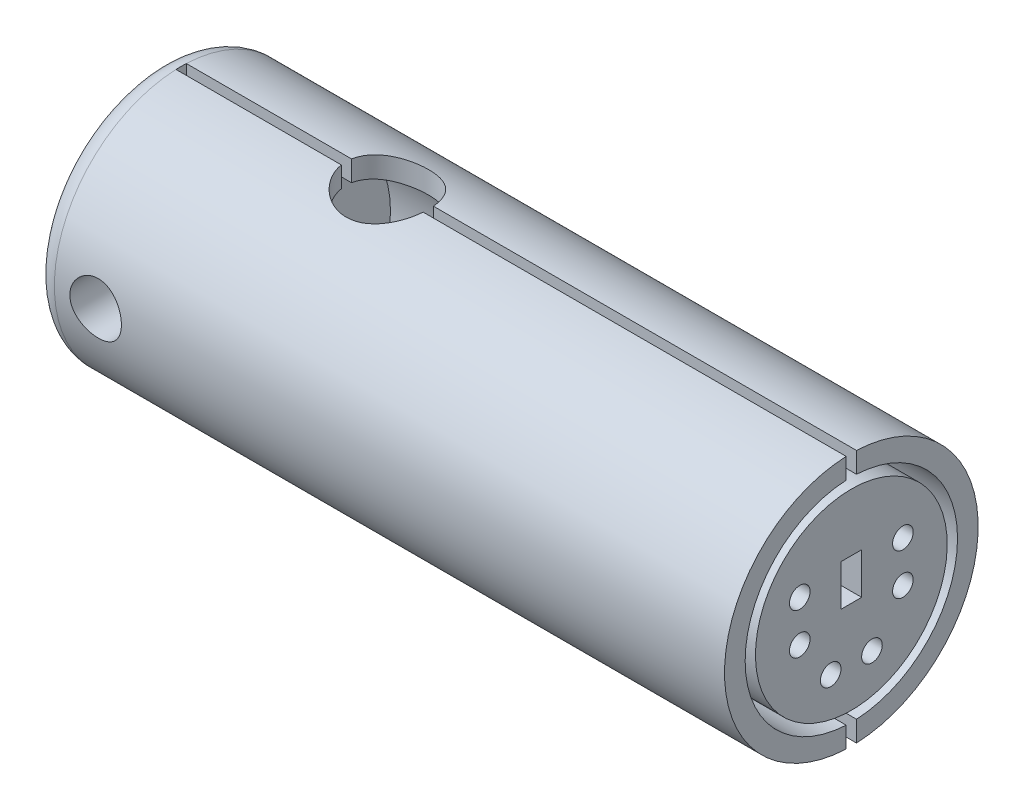
from build123d import *

# Parameters (mm, degrees)
SKETCH_1_W               = 33.5
SKETCH_1_H               = 6.15
SKETCH_2_R               = 5.15
CUT_EXTRUDE_1_DEPTH      = 27.5
SKETCH_3_R               = 2.25
CUT_EXTRUDE_2_DEPTH      = 35.610619758
SKETCH_5_W               = 0.75
SKETCH_5_H               = 4
CUT_EXTRUDE_3_DEPTH      = 35.610619758
CUT_EXTRUDE_3_DEPTH_BACK = 35.610619758
SKETCH_6_R               = 1.25
SKETCH_7_R               = 2
CUT_EXTRUDE_4_DEPTH      = 35.610619896
FILLET_1_R               = 1
CUT_EXTRUDE_START        = -32.5
SKETCH_8_W               = 0.5
SKETCH_8_H               = 12.3
CUT_EXTRUDE_5_DEPTH      = 32.5
SKETCH_9_R               = 4.65
SKETCH_9_R_2             = 0.5
SKETCH_9_W               = 1
SKETCH_9_H               = 2
EXTRUDE_1_DEPTH          = 12
EXTRUDE_START            = -5.15
SKETCH_10_R              = 1.5
EXTRUDE_2_DEPTH          = 10.3


with BuildPart() as part:
    # Эскиз1 → Повернуть1 (revolve)
    with BuildSketch(Plane.XY, mode=Mode.PRIVATE) as revolve_1_sk:
        with Locations((16.75, 3.075)):
            Rectangle(SKETCH_1_W, SKETCH_1_H)
    revolve(revolve_1_sk.sketch.rotate(Axis((0, 0, 0), (1, 0, 0)), 180), axis=Axis((0, 0, 0), (1, 0, 0)))

    # Эскиз2 → Вырез-Вытянуть1 (cut)
    with BuildSketch(Plane(origin=(33.5, 0, 0), x_dir=(0, 0, -1), z_dir=(1, 0, 0))):
        with Locations(Location((0, 0, 0), (0, 0, 90))):
            Circle(SKETCH_2_R)
    extrude(amount=-CUT_EXTRUDE_1_DEPTH, mode=Mode.SUBTRACT)

    # Эскиз3 → Вырез-Вытянуть2 (cut, through all)
    with BuildSketch(Plane.ZY):
        with Locations(Location((0, 0, 0), (0, 0, 270))):
            Circle(SKETCH_3_R)
    extrude(amount=-CUT_EXTRUDE_2_DEPTH, mode=Mode.SUBTRACT)

    # Эскиз5 → Вырез-Повернуть1 (revolve, cut)
    with BuildSketch(Plane(origin=(0, 0, 0), x_dir=(0, 1, 0), z_dir=(0, 0, 1))):
        with Locations((-2.625, -3)):
            Rectangle(SKETCH_5_W, SKETCH_5_H)
    revolve(axis=Axis((6, 0, 0), (1, 0, 0)), mode=Mode.SUBTRACT)

    # Эскиз6 → Вырез-Вытянуть3 (cut, two sides: drawn at the far end of the back side and taken through both)
    with BuildSketch(Plane(origin=(0, 0, 0), x_dir=(0, 1, 0), z_dir=(0, 0, 1)).offset(-CUT_EXTRUDE_3_DEPTH_BACK)):
        with Locations(Location((0, -3, 0), (0, 0, 270))):
            Circle(SKETCH_6_R)
    extrude(amount=CUT_EXTRUDE_3_DEPTH + CUT_EXTRUDE_3_DEPTH_BACK, mode=Mode.SUBTRACT)

    # Эскиз7 → Вырез-Вытянуть4 (cut, through all)
    with BuildSketch(Plane(origin=(0, 0, 0), x_dir=(0, 0, 1), z_dir=(0, -1, 0))):
        with Locations(Location((0, -11, 0), (0, 0, 269.999999997))):
            Circle(SKETCH_7_R)
    extrude(amount=-CUT_EXTRUDE_4_DEPTH, mode=Mode.SUBTRACT)

    # Скругление1
    fillet_1_edges = [part.edges().sort_by_distance(p)[0] for p in [
        (0, 6.15, 0),
    ]]
    fillet(fillet_1_edges, radius=FILLET_1_R)

    # Эскиз8 → Вырез-Вытянуть5 (cut)
    with BuildSketch(Plane(origin=(33.5, 0, 0), x_dir=(0, 0, -1), z_dir=(1, 0, 0)).offset(CUT_EXTRUDE_START)):
        Rectangle(SKETCH_8_W, SKETCH_8_H)
    extrude(amount=CUT_EXTRUDE_5_DEPTH, mode=Mode.SUBTRACT)



with BuildPart() as body_2:
    # Эскиз9 → Бобышка-Вытянуть1 (new body)
    with BuildSketch(Plane(origin=(33.5, 0, 0), x_dir=(0, 0, -1), z_dir=(1, 0, 0))):
        with Locations(Location((0, 0, 0), (0, 0, 90))):
            Circle(SKETCH_9_R)
        with Locations(Location((1, -2.65, 0), (0, 0, 90))):
            Circle(SKETCH_9_R_2, mode=Mode.SUBTRACT)
        with Locations(Location((2.5, -0.65, 0), (0, 0, 90))):
            Circle(SKETCH_9_R_2, mode=Mode.SUBTRACT)
        with Locations(Location((2.5, 1.35, 0), (0, 0, 90))):
            Circle(SKETCH_9_R_2, mode=Mode.SUBTRACT)
        with Locations(Location((-2.5, 1.35, 0), (0, 0, 270))):
            Circle(SKETCH_9_R_2, mode=Mode.SUBTRACT)
        with Locations(Location((-2.5, -0.65, 0), (0, 0, 270))):
            Circle(SKETCH_9_R_2, mode=Mode.SUBTRACT)
        with Locations(Location((-1, -2.65, 0), (0, 0, 270))):
            Circle(SKETCH_9_R_2, mode=Mode.SUBTRACT)
        with Locations((0, 0.85)):
            Rectangle(SKETCH_9_W, SKETCH_9_H, mode=Mode.SUBTRACT)
    extrude(amount=-EXTRUDE_1_DEPTH)


with BuildPart() as part_1:
    add(part.part)

    add(body_2.part)  # Бобышка-Вытянуть2 merges body 2
    # Эскиз10 → Бобышка-Вытянуть2 (add)
    with BuildSketch(Plane(origin=(0, 0, 0), x_dir=(0, 1, 0), z_dir=(0, 0, 1)).offset(EXTRUDE_START)):
        with Locations(Location((0, -27.5, 0), (0, 0, 90))):
            Circle(SKETCH_10_R)
    extrude(amount=EXTRUDE_2_DEPTH)


solid = part_1.part
